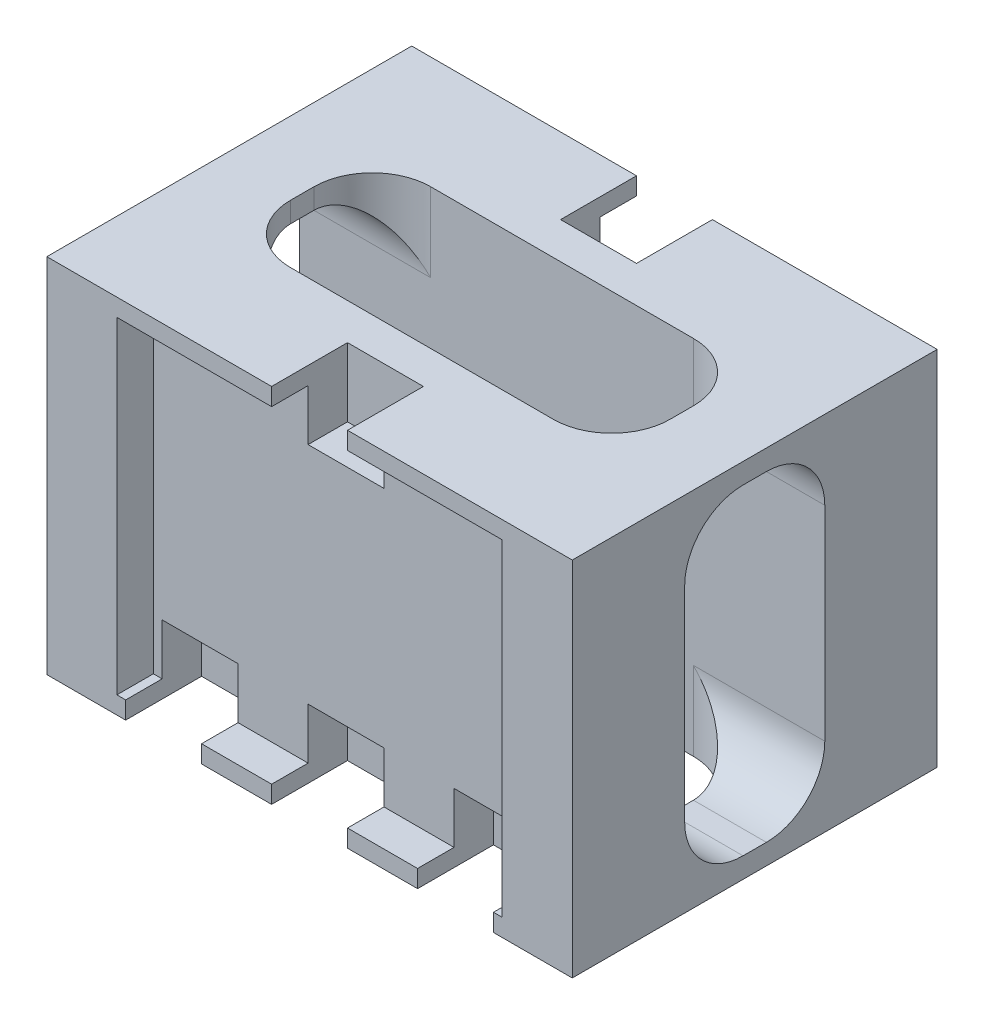
from build123d import *

# Parameters (mm, degrees)
SKETCH1_W           = 45.72
SKETCH1_H           = 31.75
BOSS_EXTRUDE1_DEPTH = 40.64
SKETCH2_W           = 33.528
SKETCH2_H           = 28.448
CUT_EXTRUDE1_DEPTH  = 3.175
SKETCH3_W           = 6.604
SKETCH3_H           = 6.096
CUT_EXTRUDE2_DEPTH  = 6.604
SKETCH4_W           = 6.604
SKETCH4_H           = 4.445
CUT_EXTRUDE3_DEPTH  = 3.429
SKETCH5_W           = 33.02
SKETCH5_H           = 12.192
CUT_EXTRUDE4_DEPTH  = 50.256520634
SKETCH6_W           = 12.192
SKETCH6_H           = 27.94
CUT_EXTRUDE5_DEPTH  = 64.197655218
FILLET1_R           = 5.08
FILLET2_R           = 5.08
SKETCH7_W           = 45.72
SKETCH7_H           = 31.75
CUT_EXTRUDE6_DEPTH  = 4.572
SKETCH8_W           = 45.72
SKETCH8_H           = 31.75
CUT_EXTRUDE7_DEPTH  = 4.572


with BuildPart() as part:
    # Sketch1 → Boss-Extrude1 (new body)
    with BuildSketch(Plane(origin=(0, 0, 0), x_dir=(1, 0, 0), z_dir=(0, 1, 0))):
        Rectangle(SKETCH1_W, SKETCH1_H)
    extrude(amount=BOSS_EXTRUDE1_DEPTH)

    # Sketch2 → Cut-Extrude1 (cut)
    with BuildSketch(Plane.XY.offset(15.875)):
        with Locations((0, 20.32)):
            Rectangle(SKETCH2_W, SKETCH2_H)
    cut_extrude1 = extrude(amount=-CUT_EXTRUDE1_DEPTH, mode=Mode.SUBTRACT)

    # Sketch3 → Cut-Extrude2 (cut)
    with BuildSketch(Plane.XY.offset(15.875)):
        with Locations((0, 37.592)):
            Rectangle(SKETCH3_W, SKETCH3_H)
        with Locations((0, 3.048)):
            Rectangle(SKETCH3_W, SKETCH3_H)
        with Locations((-12.7, 3.048)):
            Rectangle(SKETCH3_W, SKETCH3_H)
        with Locations((12.7, 3.048)):
            Rectangle(SKETCH3_W, SKETCH3_H)
    cut_extrude2 = extrude(amount=-CUT_EXTRUDE2_DEPTH, mode=Mode.SUBTRACT)

    # Sketch4 → Cut-Extrude3 (cut)
    with BuildSketch(Plane.XY.offset(12.7)):
        with Locations((0, 32.3215)):
            Rectangle(SKETCH4_W, SKETCH4_H)
        with Locations((-12.7, 8.3185)):
            Rectangle(SKETCH4_W, SKETCH4_H)
        with Locations((0, 8.3185)):
            Rectangle(SKETCH4_W, SKETCH4_H)
        with Locations((12.7, 8.3185)):
            Rectangle(SKETCH4_W, SKETCH4_H)
    cut_extrude3 = extrude(amount=-CUT_EXTRUDE3_DEPTH, mode=Mode.SUBTRACT)

    # Mirror1: Cut-Extrude1, Cut-Extrude2, Cut-Extrude3 across plane
    add(cut_extrude1.mirror(Plane.XY), mode=Mode.SUBTRACT)
    add(cut_extrude2.mirror(Plane.XY), mode=Mode.SUBTRACT)
    add(cut_extrude3.mirror(Plane.XY), mode=Mode.SUBTRACT)

    # Sketch5 → Cut-Extrude4 (cut, through all)
    with BuildSketch(Plane(origin=(0, 40.64, 0), x_dir=(1, 0, 0), z_dir=(0, 1, 0))):
        Rectangle(SKETCH5_W, SKETCH5_H)
    extrude(amount=-CUT_EXTRUDE4_DEPTH, mode=Mode.SUBTRACT)

    # Sketch6 → Cut-Extrude5 (cut, through all)
    with BuildSketch(Plane.ZY.offset(22.86)):
        with Locations((0, 20.32)):
            Rectangle(SKETCH6_W, SKETCH6_H)
    extrude(amount=-CUT_EXTRUDE5_DEPTH, mode=Mode.SUBTRACT)

    # Fillet1
    fillet1_edges = [part.edges().sort_by_distance(p)[0] for p in [
        (16.51, 3.175, -6.096),
        (16.51, 3.175, 6.096),
        (-16.51, 3.175, 6.096),
        (-16.51, 3.175, -6.096),
        (-16.51, 37.465, -6.096),
        (16.51, 37.465, -6.096),
        (-16.51, 37.465, 6.096),
        (16.51, 37.465, 6.096),
    ]]
    fillet(fillet1_edges, radius=FILLET1_R)

    # Fillet2
    fillet2_edges = [part.edges().sort_by_distance(p)[0] for p in [
        (-17.145, 6.35, 6.096),
        (-17.145, 6.35, -6.096),
        (-17.145, 34.29, 6.096),
        (-17.145, 34.29, -6.096),
        (17.145, 34.29, 6.096),
        (17.145, 34.29, -6.096),
        (17.145, 6.35, 6.096),
        (17.145, 6.35, -6.096),
    ]]
    fillet(fillet2_edges, radius=FILLET2_R)

    # Sketch7 → Cut-Extrude6 (cut)
    with BuildSketch(Plane(origin=(0, 40.64, 0), x_dir=(1, 0, 0), z_dir=(0, 1, 0))):
        Rectangle(SKETCH7_W, SKETCH7_H)
    extrude(amount=-CUT_EXTRUDE6_DEPTH, mode=Mode.SUBTRACT)

    # Sketch8 → Cut-Extrude7 (cut)
    with BuildSketch(Plane.XZ):
        Rectangle(SKETCH8_W, SKETCH8_H)
    extrude(amount=-CUT_EXTRUDE7_DEPTH, mode=Mode.SUBTRACT)


solid = part.part
